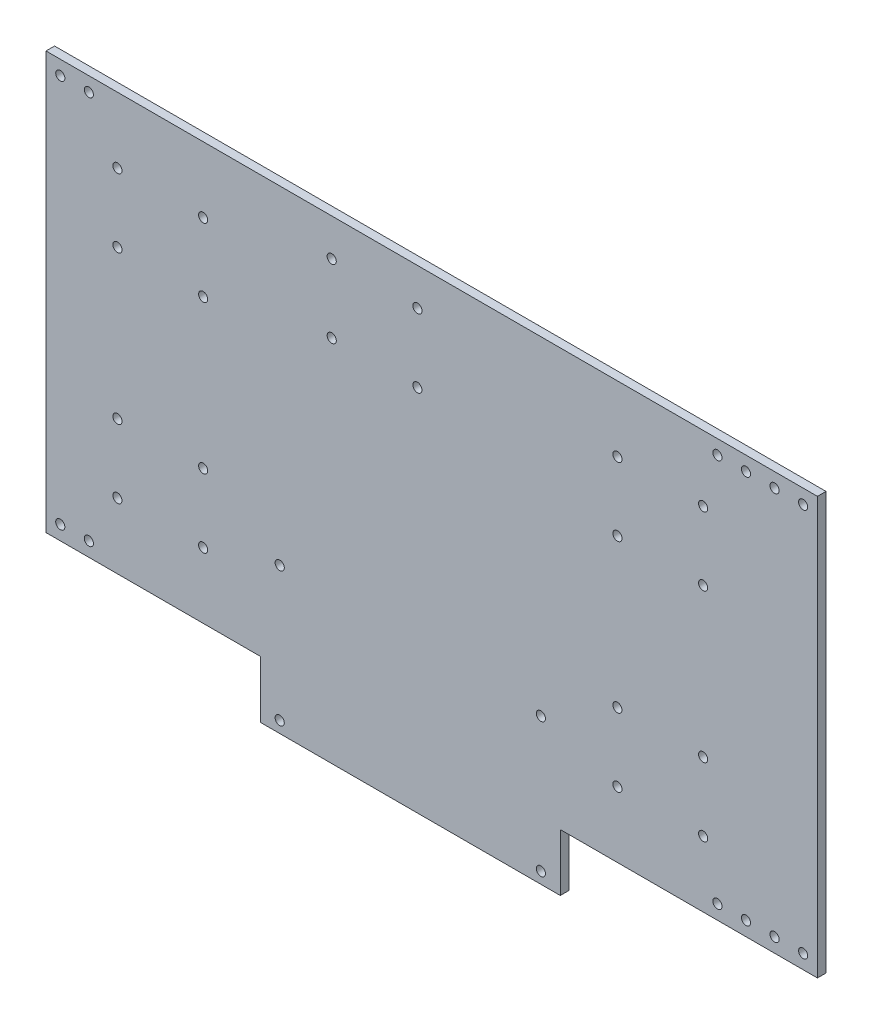
from build123d import *

# Parameters (mm, degrees)
SKETCH_1_R          = 1.6
EXTRUDE_1_DEPTH     = 3
SKETCH_4_R          = 1.6
CUT_EXTRUDE_1_DEPTH = 212.03104629


with BuildPart() as part:
    # 草图1 → 凸台-拉伸1 (new body)
    with BuildSketch(Plane.XY):
        Polygon((165.87891634, -46.129428967), (185.87891634, -46.129428967), (185.87891634, 99.870571033), (165.87891634, 99.870571033), (95.87891634, 99.870571033), (-9.12108366, 99.870571033), (-79.12108366, 99.870571033), (-84.12108366, 99.870571033), (-84.12108366, -46.129428967), (-79.12108366, -46.129428967), (-9.12108366, -46.129428967), (-9.12108366, -66.129428967), (95.87891634, -66.129428967), (95.87891634, -46.129428967), align=None)
        with Locations((-59.12108366, 0.870571033)):
            Circle(SKETCH_1_R, mode=Mode.SUBTRACT)
        with Locations((-29.12108366, 0.870571033)):
            Circle(SKETCH_1_R, mode=Mode.SUBTRACT)
        with Locations((-59.12108366, -23.129428967)):
            Circle(SKETCH_1_R, mode=Mode.SUBTRACT)
        with Locations((-29.12108366, -23.129428967)):
            Circle(SKETCH_1_R, mode=Mode.SUBTRACT)
        with Locations((115.87891634, 0.870571033)):
            Circle(SKETCH_1_R, mode=Mode.SUBTRACT)
        with Locations((145.87891634, 0.870571033)):
            Circle(SKETCH_1_R, mode=Mode.SUBTRACT)
        with Locations((115.87891634, -23.129428967)):
            Circle(SKETCH_1_R, mode=Mode.SUBTRACT)
        with Locations((145.87891634, -23.129428967)):
            Circle(SKETCH_1_R, mode=Mode.SUBTRACT)
        with Locations((-2.32108366, -62.129428967)):
            Circle(SKETCH_1_R, mode=Mode.SUBTRACT)
        with Locations((-2.32108366, -15.129428967)):
            Circle(SKETCH_1_R, mode=Mode.SUBTRACT)
        with Locations((89.07891634, -15.129428967)):
            Circle(SKETCH_1_R, mode=Mode.SUBTRACT)
        with Locations((89.07891634, -62.129428967)):
            Circle(SKETCH_1_R, mode=Mode.SUBTRACT)
        with Locations(Location((145.87891634, 76.870571033, 0), (0, 0, 180))):
            Circle(SKETCH_1_R, mode=Mode.SUBTRACT)
        with Locations(Location((115.87891634, 76.870571033, 0), (0, 0, 180))):
            Circle(SKETCH_1_R, mode=Mode.SUBTRACT)
        with Locations(Location((145.87891634, 52.870571033, 0), (0, 0, 180))):
            Circle(SKETCH_1_R, mode=Mode.SUBTRACT)
        with Locations(Location((115.87891634, 52.870571033, 0), (0, 0, 180))):
            Circle(SKETCH_1_R, mode=Mode.SUBTRACT)
        with Locations(Location((-29.12108366, 76.870571033, 0), (0, 0, 180))):
            Circle(SKETCH_1_R, mode=Mode.SUBTRACT)
        with Locations(Location((-59.12108366, 76.870571033, 0), (0, 0, 180))):
            Circle(SKETCH_1_R, mode=Mode.SUBTRACT)
        with Locations(Location((-29.12108366, 52.870571033, 0), (0, 0, 180))):
            Circle(SKETCH_1_R, mode=Mode.SUBTRACT)
        with Locations(Location((-59.12108366, 52.870571033, 0), (0, 0, 180))):
            Circle(SKETCH_1_R, mode=Mode.SUBTRACT)
        with Locations((15.87891634, 86.870571033)):
            Circle(SKETCH_1_R, mode=Mode.SUBTRACT)
        with Locations((45.87891634, 86.870571033)):
            Circle(SKETCH_1_R, mode=Mode.SUBTRACT)
        with Locations((15.87891634, 62.870571033)):
            Circle(SKETCH_1_R, mode=Mode.SUBTRACT)
        with Locations((45.87891634, 62.870571033)):
            Circle(SKETCH_1_R, mode=Mode.SUBTRACT)
        with Locations((-79.12108366, -41.129428967)):
            Circle(SKETCH_1_R, mode=Mode.SUBTRACT)
        with Locations((-69.12108366, -41.129428967)):
            Circle(SKETCH_1_R, mode=Mode.SUBTRACT)
        with Locations(Location((-79.12108366, 94.870571033, 0), (0, 0, 180))):
            Circle(SKETCH_1_R, mode=Mode.SUBTRACT)
        with Locations(Location((-69.12108366, 94.870571033, 0), (0, 0, 180))):
            Circle(SKETCH_1_R, mode=Mode.SUBTRACT)
    extrude(amount=EXTRUDE_1_DEPTH)

    # 草图4 → 切除-拉伸1 (cut, through all)
    with BuildSketch(Plane.XY.offset(3)):
        with Locations((170.87891634, 94.870571033)):
            Circle(SKETCH_4_R)
        with Locations((180.87891634, 94.870571033)):
            Circle(SKETCH_4_R)
        with Locations((170.87891634, -41.129428967)):
            Circle(SKETCH_4_R)
        with Locations((180.87891634, -41.129428967)):
            Circle(SKETCH_4_R)
        with Locations((150.87891634, -41.129428967)):
            Circle(SKETCH_4_R)
        with Locations((160.87891634, -41.129428967)):
            Circle(SKETCH_4_R)
        with Locations(Location((150.87891634, 94.870571033, 0), (0, 0, 180))):
            Circle(SKETCH_4_R)
        with Locations(Location((160.87891634, 94.870571033, 0), (0, 0, 180))):
            Circle(SKETCH_4_R)
    extrude(amount=-CUT_EXTRUDE_1_DEPTH, mode=Mode.SUBTRACT)


solid = part.part
